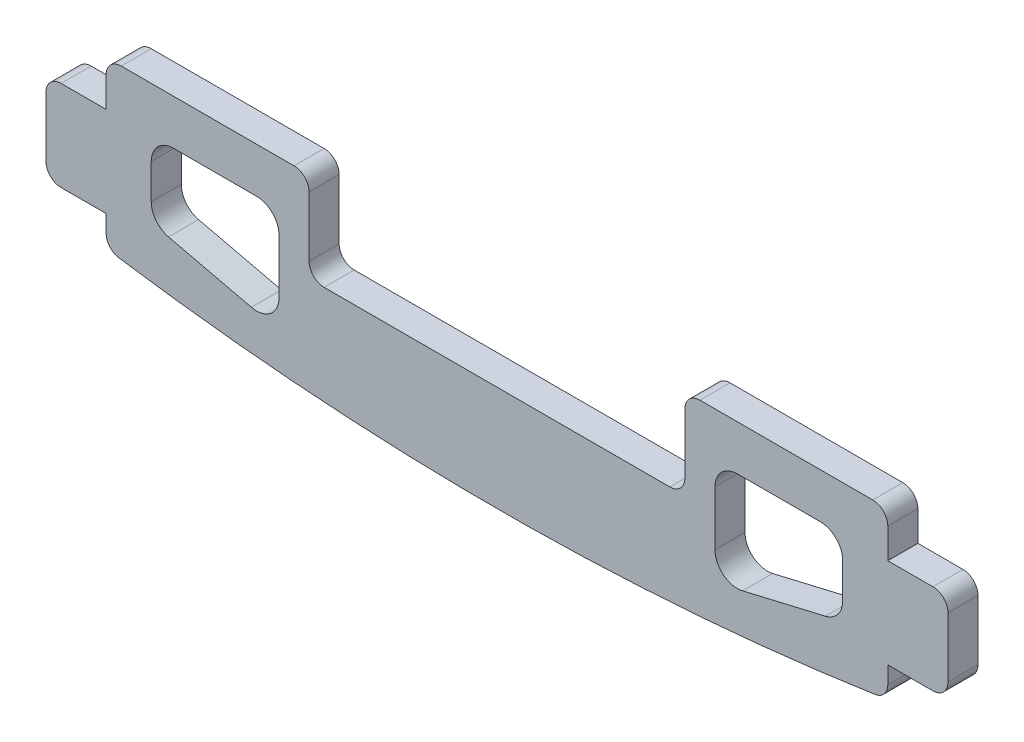
from build123d import *

# Parameters (mm, degrees)
RESSALTO_EXTRUS_O1_DEPTH = 2


with BuildPart() as part:
    # Esboço1 → Ressalto-extrusão1 (new body)
    with BuildSketch(Plane.XY):
        with BuildLine():
            Line((-11.5, 0), (11.5, 0))
            ThreePointArc((11.5, 0), (12.207106781, 0.292893219), (12.5, 1))
            Line((12.5, 1), (12.5, 5))
            ThreePointArc((12.5, 5), (12.792893219, 5.707106781), (13.5, 6))
            Line((13.5, 6), (25, 6))
            ThreePointArc((25, 6), (25.707106781, 5.707106781), (26, 5))
            Line((26, 5), (26, 3))
            Line((26, 3), (29, 3))
            ThreePointArc((29, 3), (29.707106781, 2.707106781), (30, 2))
            Line((30, 2), (30, -2))
            ThreePointArc((30, -2), (29.707106781, -2.707106781), (29, -3))
            Line((29, -3), (26, -3))
            Line((26, -3), (26, -4.140659326))
            ThreePointArc((26, -4.140659326), (25.757604446, -4.793373278), (25.147928994, -5.12965731))
            ThreePointArc((25.147928994, -5.12965731), (12.608692582, -6.531769505), (0, -7))
            ThreePointArc((0, -7), (-12.608692582, -6.531769505), (-25.147928994, -5.12965731))
            ThreePointArc((-25.147928994, -5.12965731), (-25.757604446, -4.793373278), (-26, -4.140659326))
            Line((-26, -4.140659326), (-26, -3))
            Line((-26, -3), (-29, -3))
            ThreePointArc((-29, -3), (-29.707106781, -2.707106781), (-30, -2))
            Line((-30, -2), (-30, 2))
            ThreePointArc((-30, 2), (-29.707106781, 2.707106781), (-29, 3))
            Line((-29, 3), (-26, 3))
            Line((-26, 3), (-26, 5))
            ThreePointArc((-26, 5), (-25.707106781, 5.707106781), (-25, 6))
            Line((-25, 6), (-13.5, 6))
            ThreePointArc((-13.5, 6), (-12.792893219, 5.707106781), (-12.5, 5))
            Line((-12.5, 5), (-12.5, 1))
            ThreePointArc((-12.5, 1), (-12.207106781, 0.292893219), (-11.5, 0))
        make_face()
        with BuildLine():
            Line((15.99403097, 3), (21.50596903, 3))
            ThreePointArc((21.50596903, 3), (22.56240846, 2.56240846), (23, 1.50596903))
            Line((23, 1.50596903), (23, -0.816705571))
            ThreePointArc((23, -0.816705571), (22.677159402, -1.744305514), (21.848160888, -2.271020968))
            Line((21.848160888, -2.271020968), (16.336222828, -3.56794757))
            ThreePointArc((16.336222828, -3.56794757), (15.066431028, -3.284822545), (14.5, -2.113632174))
            Line((14.5, -2.113632174), (14.5, 1.50596903))
            ThreePointArc((14.5, 1.50596903), (14.93759154, 2.56240846), (15.99403097, 3))
        make_face(mode=Mode.SUBTRACT)
        with BuildLine():
            Line((-14.5, -2.113632174), (-14.5, 1.50596903))
            ThreePointArc((-14.5, 1.50596903), (-14.93759154, 2.56240846), (-15.99403097, 3))
            Line((-15.99403097, 3), (-21.50596903, 3))
            ThreePointArc((-21.50596903, 3), (-22.56240846, 2.56240846), (-23, 1.50596903))
            Line((-23, 1.50596903), (-23, -0.816705571))
            ThreePointArc((-23, -0.816705571), (-22.677159402, -1.744305514), (-21.848160888, -2.271020968))
            Line((-21.848160888, -2.271020968), (-16.336222828, -3.56794757))
            ThreePointArc((-16.336222828, -3.56794757), (-15.066431028, -3.284822545), (-14.5, -2.113632174))
        make_face(mode=Mode.SUBTRACT)
    extrude(amount=RESSALTO_EXTRUS_O1_DEPTH)


solid = part.part
